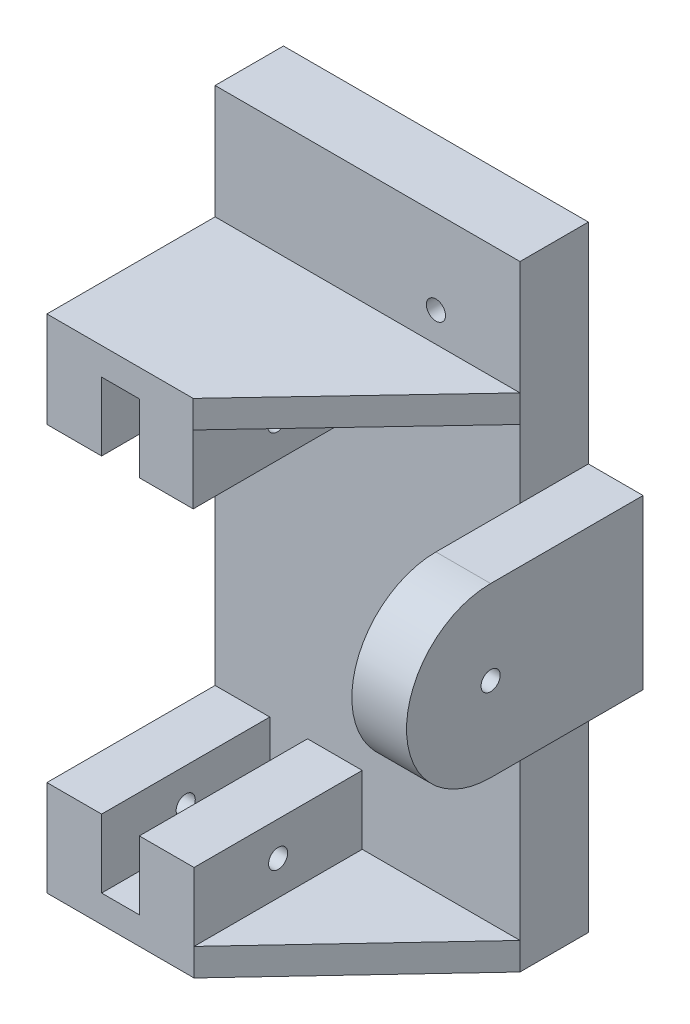
from build123d import *

# Parameters (mm, degrees)
ESQUISSE1_W             = 22.3
ESQUISSE1_H             = 43
ESQUISSE1_R             = 2.45
BOSS_EXTRU_1_DEPTH      = 5
BOSS_EXTRU_2_START      = -2.47
ESQUISSE2_R             = 2.45
ESQUISSE2_R_2           = 0.7
BOSS_EXTRU_2_DEPTH      = 2.47
ESQUISSE3_W             = 4
ESQUISSE3_H             = 5
ESQUISSE3_W_2           = 3.94
BOSS_EXTRU_3_DEPTH      = 12.3
ESQUISSE4_R             = 0.7
ENL_V_MAT_EXTRU_1_DEPTH = 52.435201954
BOSS_EXTRU_4_DEPTH      = 2
BOSS_EXTRU_5_DEPTH      = 2
ESQUISSE7_R             = 0.7
BOSS_EXTRU_6_DEPTH      = 4


with BuildPart() as part:
    # Esquisse1 → Boss.-Extru.1 (new body)
    with BuildSketch(Plane.XY):
        with Locations((-11.15, -21.5)):
            Rectangle(ESQUISSE1_W, ESQUISSE1_H)
        with Locations((-6.15, -6.15)):
            Circle(ESQUISSE1_R, mode=Mode.SUBTRACT)
    extrude(amount=BOSS_EXTRU_1_DEPTH)

    # Esquisse2 → Boss.-Extru.2 (add)
    with BuildSketch(Plane.XY.offset(5).offset(BOSS_EXTRU_2_START)):
        with Locations((-6.15, -6.15)):
            Circle(ESQUISSE2_R)
        with Locations((-6.15, -6.15)):
            Circle(ESQUISSE2_R_2, mode=Mode.SUBTRACT)
    extrude(amount=BOSS_EXTRU_2_DEPTH)

    # Esquisse3 → Boss.-Extru.3 (add)
    with BuildSketch(Plane.XY.offset(5)):
        with Locations((-20.3, -40.5)):
            Rectangle(ESQUISSE3_W, ESQUISSE3_H)
        with Locations((-13.54, -40.5)):
            Rectangle(ESQUISSE3_W, ESQUISSE3_H)
        with Locations((-20.3, -12.82)):
            Rectangle(ESQUISSE3_W, ESQUISSE3_H)
        with Locations((-13.57, -12.82)):
            Rectangle(ESQUISSE3_W_2, ESQUISSE3_H)
    extrude(amount=BOSS_EXTRU_3_DEPTH)

    # Esquisse4 → Enlèv. mat.-Extru.1 (cut, through all)
    with BuildSketch(Plane.ZY.offset(22.3)):
        with Locations((11.15, -12.82)):
            Circle(ESQUISSE4_R)
        with Locations((11.15, -40.5)):
            Circle(ESQUISSE4_R)
    extrude(amount=-ENL_V_MAT_EXTRU_1_DEPTH, mode=Mode.SUBTRACT)

    # Esquisse5 → Boss.-Extru.4 (add)
    with BuildSketch(Plane.XZ.offset(43)):
        Polygon((-22.3, 17.3), (-11.54, 17.3), (0, 5), (0, 0), (-22.3, 0), align=None)
    extrude(amount=BOSS_EXTRU_4_DEPTH)

    # Esquisse6 → Boss.-Extru.5 (add)
    with BuildSketch(Plane(origin=(0, -10.32, 0), x_dir=(1, 0, 0), z_dir=(0, 1, 0))):
        Polygon((-22.3, -5), (-22.3, -17.3), (-11.6, -17.3), (0, -5), align=None)
    extrude(amount=BOSS_EXTRU_5_DEPTH)

    # Esquisse7 → Boss.-Extru.6 (add)
    with BuildSketch(Plane(origin=(0, 0, 0), x_dir=(0, 0, -1), z_dir=(1, 0, 0))):
        with BuildLine():
            Line((-11.15, -15.32), (0, -15.32))
            Line((0, -15.32), (0, -27.62))
            Line((0, -27.62), (-11.15, -27.62))
            ThreePointArc((-11.15, -27.62), (-17.3, -21.47), (-11.15, -15.32))
        make_face()
        with Locations(Location((-11.15, -21.47, 0), (0, 0, 90))):
            Circle(ESQUISSE7_R, mode=Mode.SUBTRACT)
    extrude(amount=BOSS_EXTRU_6_DEPTH)


solid = part.part
